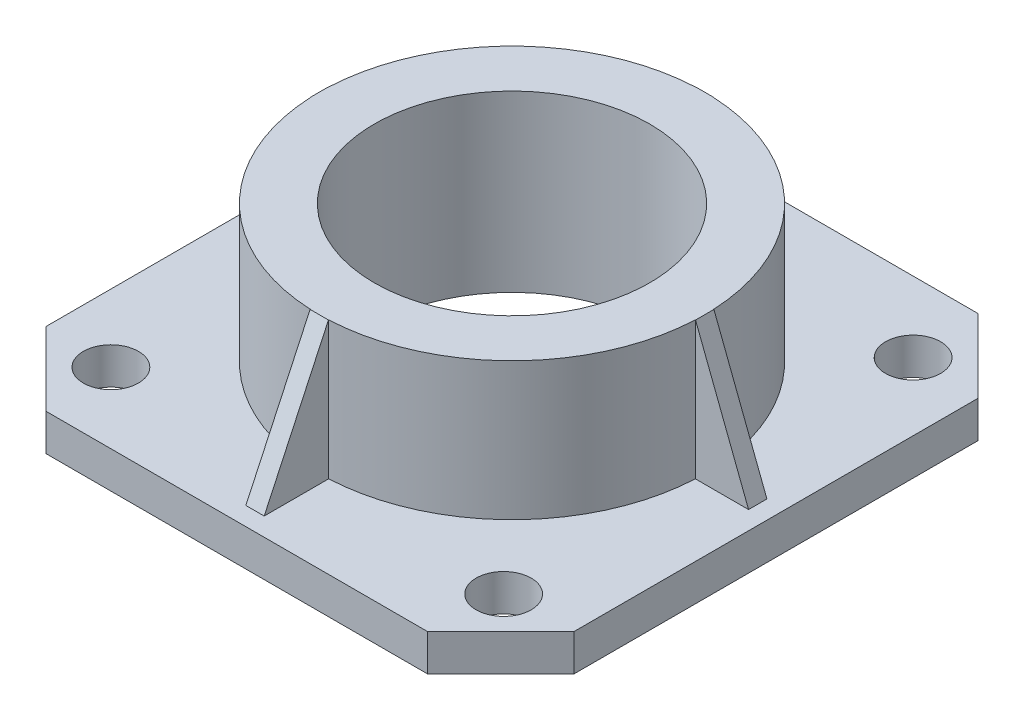
from build123d import *

# Parameters (mm, degrees)
SKETCH1_R                = 7.5
SKETCH1_R_2              = 1.5
BOSS_EXTRUDE1_DEPTH      = 2
SKETCH2_R                = 10.5
SKETCH2_R_2              = 7.5
BOSS_EXTRUDE2_DEPTH      = 7.5
BOSS_EXTRUDE4_DEPTH      = 0.5
BOSS_EXTRUDE4_DEPTH_BACK = 0.5
BOSS_EXTRUDE5_DEPTH      = 0.5
BOSS_EXTRUDE5_DEPTH_BACK = 0.5


with BuildPart() as part:
    # Sketch1 → Boss-Extrude1 (new body)
    with BuildSketch(Plane(origin=(0, 0, 0), x_dir=(1, 0, 0), z_dir=(0, 1, 0))):
        Polygon((-14.387647793, 11), (-10.387647793, 15), (10.387647793, 15), (14.387647793, 11), (14.387647793, -11), (10.387647793, -15), (-10.387647793, -15), (-14.387647793, -11), align=None)
        with Locations(Location((0, 0, 0), (0, 0, 270))):
            Circle(SKETCH1_R, mode=Mode.SUBTRACT)
        with Locations(Location((-10.69839003, -11.153723858, 0), (0, 0, 270))):
            Circle(SKETCH1_R_2, mode=Mode.SUBTRACT)
        with Locations(Location((-10.69839003, 11.153723858, 0), (0, 0, 270))):
            Circle(SKETCH1_R_2, mode=Mode.SUBTRACT)
        with Locations(Location((10.69839003, 11.153723858, 0), (0, 0, 270))):
            Circle(SKETCH1_R_2, mode=Mode.SUBTRACT)
        with Locations(Location((10.69839003, -11.153723858, 0), (0, 0, 270))):
            Circle(SKETCH1_R_2, mode=Mode.SUBTRACT)
    extrude(amount=BOSS_EXTRUDE1_DEPTH)

    # Sketch2 → Boss-Extrude2 (add)
    with BuildSketch(Plane(origin=(0, 2, 0), x_dir=(1, 0, 0), z_dir=(0, 1, 0))):
        with Locations(Location((0, 0, 0), (0, 0, 90))):
            Circle(SKETCH2_R)
        with Locations(Location((0, 0, 0), (0, 0, 270))):
            Circle(SKETCH2_R_2, mode=Mode.SUBTRACT)
    extrude(amount=BOSS_EXTRUDE2_DEPTH)

    # Sketch4 → Boss-Extrude4 (add, two sides: drawn at the far end of the back side and taken through both)
    with BuildSketch(Plane(origin=(0, 0, 0), x_dir=(0, 0, -1), z_dir=(1, 0, 0)).offset(-BOSS_EXTRUDE4_DEPTH_BACK)):
        Polygon((10.5, 9.5), (14, 2), (7.5, 2), (7.5, 9.5), align=None)
        Polygon((-10.5, 9.5), (-7.5, 9.5), (-7.5, 2), (-14, 2), align=None)
    extrude(amount=BOSS_EXTRUDE4_DEPTH + BOSS_EXTRUDE4_DEPTH_BACK)

    # Sketch5 → Boss-Extrude5 (add, two sides: drawn at the far end of the back side and taken through both)
    with BuildSketch(Plane.XY.offset(-BOSS_EXTRUDE5_DEPTH_BACK)):
        Polygon((-10.5, 9.5), (-13.387647793, 2), (-7.5, 2), (-7.5, 9.5), align=None)
        Polygon((10.5, 9.5), (13.387647793, 2), (7.5, 2), (7.5, 9.5), align=None)
    extrude(amount=BOSS_EXTRUDE5_DEPTH + BOSS_EXTRUDE5_DEPTH_BACK)


solid = part.part
